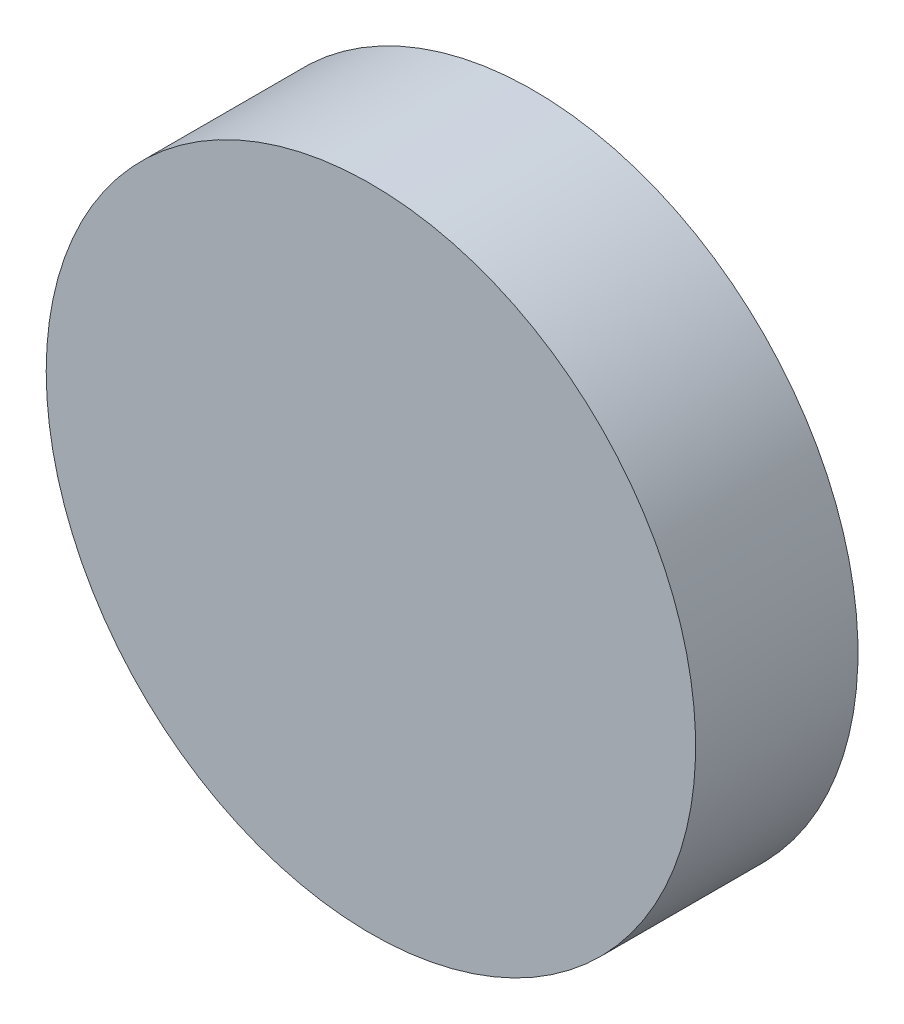
from build123d import *

# Parameters (mm, degrees)
SKETCH1_W = 4
SKETCH1_H = 2


with BuildPart() as part:
    # Sketch1 → Revolve1 (revolve)
    with BuildSketch(Plane(origin=(0, 0, 0), x_dir=(1, 0, 0), z_dir=(0, 1, 0))):
        with Locations((-2, 1)):
            Rectangle(SKETCH1_W, SKETCH1_H)
    revolve(axis=Axis((0, 0, -2), (0, 0, 1)))


solid = part.part
